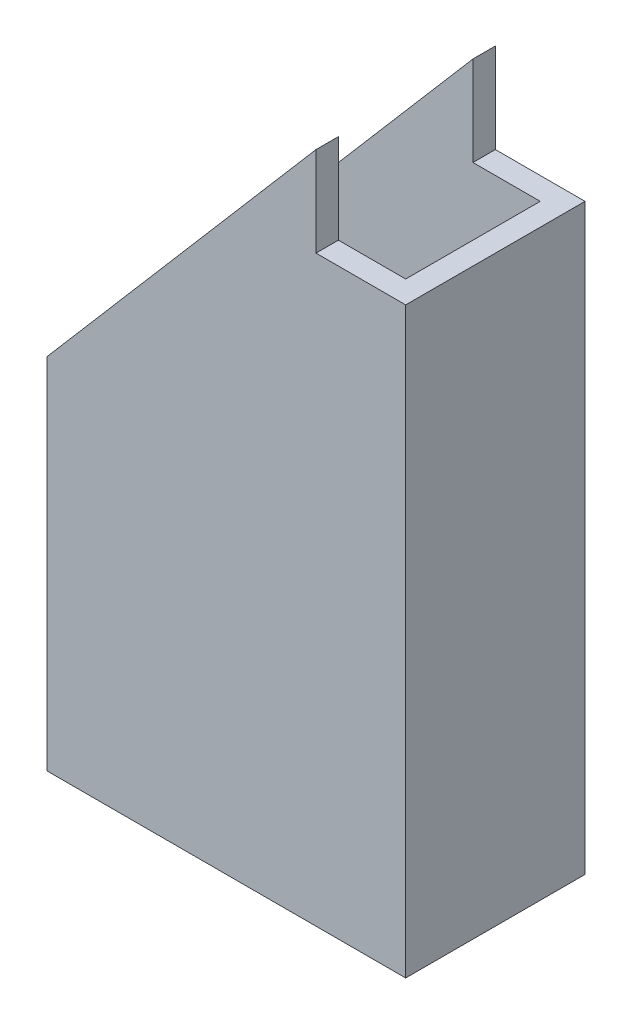
from build123d import *

# Parameters (mm, degrees)
BOSS_EXTRUDE1_DEPTH = 12.7
SKETCH2_W           = 44.45
SKETCH2_H           = 19.05
CUT_EXTRUDE1_DEPTH  = 100.3932216


with BuildPart() as part:
    # Sketch1 → Boss-Extrude1 (new, symmetric)
    with BuildSketch(Plane.XY):
        Polygon((-25.4, -47.625), (25.4, -47.625), (25.4, 34.925), (12.7, 34.925), (12.7, 47.625), (-25.4, 3.175), align=None)
    extrude(amount=BOSS_EXTRUDE1_DEPTH, both=True)

    # Sketch2 → Cut-Extrude1 (cut, through all)
    with BuildSketch(Plane.XZ.offset(47.625)):
        Rectangle(SKETCH2_W, SKETCH2_H)
    extrude(amount=-CUT_EXTRUDE1_DEPTH, mode=Mode.SUBTRACT)


solid = part.part
